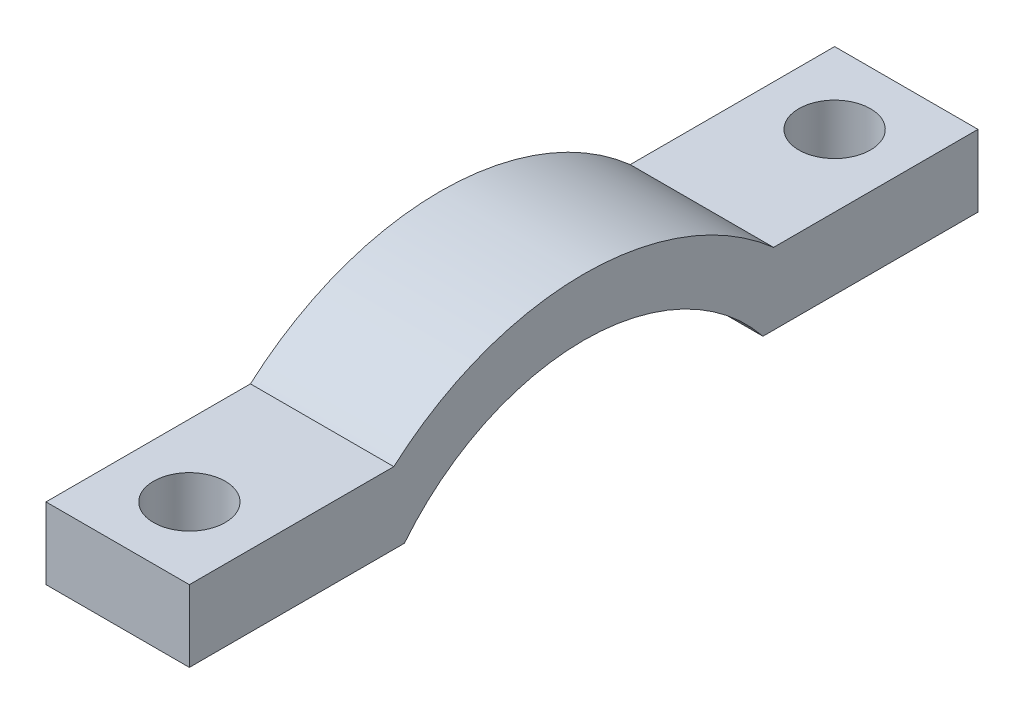
from build123d import *

# Parameters (mm, degrees)
BASE_DEPTH           = 10
ESQUISSE5_R          = 2.5
VIDE_ACCES_VIS_DEPTH = 31.929020524


with BuildPart() as part:
    # Esquisse2 → BASE (new body)
    with BuildSketch(Plane(origin=(0, 0, 0), x_dir=(0, 0, -1), z_dir=(1, 0, 0))):
        with BuildLine():
            Line((-27.502803686, 10), (-14.361406616, 10))
            Line((-14.361406616, 10), (-12.502803686, 10))
            ThreePointArc((-12.502803686, 10), (0, 16.01), (12.502803686, 10))
            Line((12.502803686, 10), (14.361406616, 10))
            Line((14.361406616, 10), (22.502803686, 10))
            Line((22.502803686, 10), (27.502803686, 10))
            Line((27.502803686, 10), (27.502803686, 15))
            Line((27.502803686, 15), (13.24387028, 15))
            ThreePointArc((13.24387028, 15), (0, 20.01), (-13.24387028, 15))
            Line((-13.24387028, 15), (-27.502803686, 15))
            Line((-27.502803686, 15), (-27.502803686, 10))
        make_face()
    extrude(amount=BASE_DEPTH)

    # Esquisse5 → VIDE ACCES VIS (cut, through all)
    with BuildSketch(Plane.XZ.offset(-10)):
        with Locations(Location((5, 22.502803686, 0), (0, 0, 270))):
            Circle(ESQUISSE5_R)
        with Locations(Location((5, -22.502803686, 0), (0, 0, 270))):
            Circle(ESQUISSE5_R)
    extrude(amount=-VIDE_ACCES_VIS_DEPTH, mode=Mode.SUBTRACT)


solid = part.part
